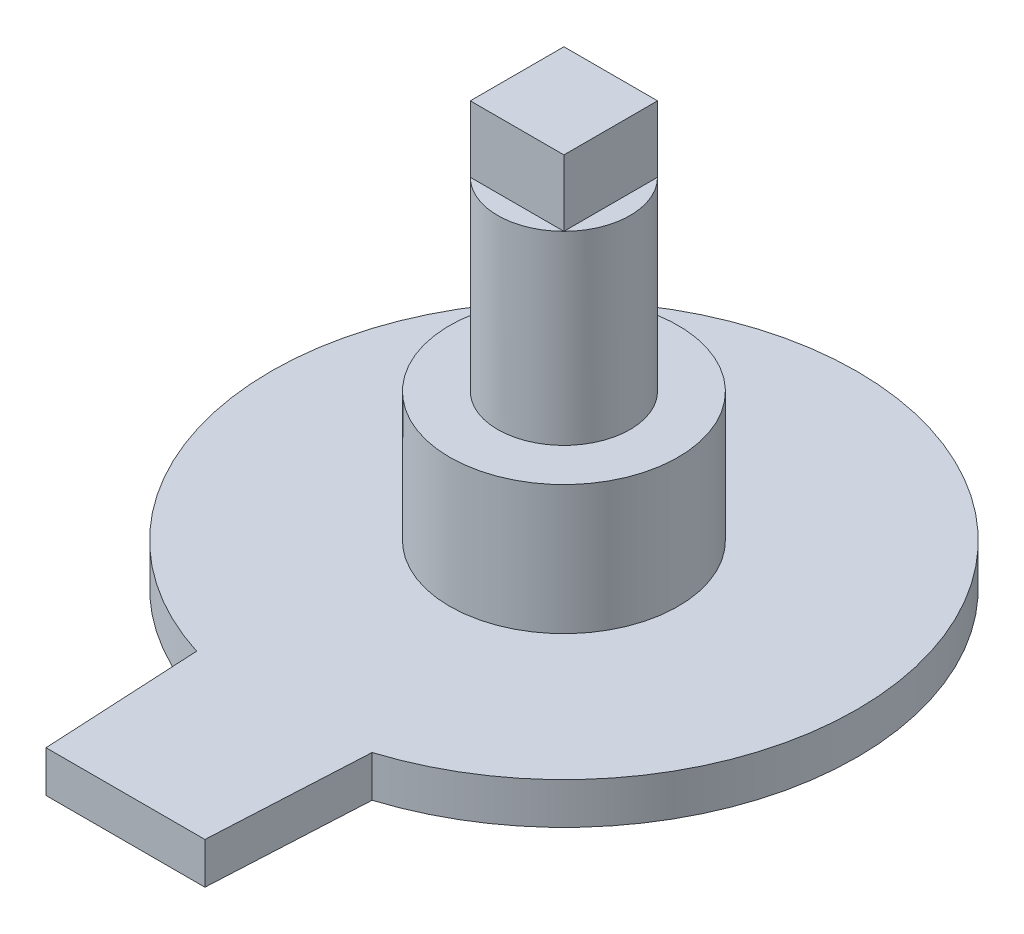
from build123d import *

# Parameters (mm, degrees)
SKETCH1_R           = 8.85
BOSS_EXTRUDE1_DEPTH = 1.25
SKETCH2_R           = 3.45
BOSS_EXTRUDE2_DEPTH = 3.9
SKETCH3_R           = 2
BOSS_EXTRUDE3_DEPTH = 5.6
SKETCH4_W           = 2.828427124
SKETCH4_H           = 2.828427124
BOSS_EXTRUDE4_DEPTH = 2
BOSS_EXTRUDE5_DEPTH = 1.25


with BuildPart() as part:
    # Sketch1 → Boss-Extrude1 (new body)
    with BuildSketch(Plane(origin=(0, 0, 0), x_dir=(1, 0, 0), z_dir=(0, 1, 0))):
        with Locations(Location((0, 0, 0), (0, 0, 270))):
            Circle(SKETCH1_R)
    extrude(amount=BOSS_EXTRUDE1_DEPTH)

    # Sketch2 → Boss-Extrude2 (add)
    with BuildSketch(Plane(origin=(0, 1.25, 0), x_dir=(1, 0, 0), z_dir=(0, 1, 0))):
        with Locations(Location((0, 0, 0), (0, 0, 270))):
            Circle(SKETCH2_R)
    extrude(amount=BOSS_EXTRUDE2_DEPTH)

    # Sketch3 → Boss-Extrude3 (add)
    with BuildSketch(Plane(origin=(0, 5.15, 0), x_dir=(1, 0, 0), z_dir=(0, 1, 0))):
        with Locations(Location((0, 0, 0), (0, 0, 270))):
            Circle(SKETCH3_R)
    extrude(amount=BOSS_EXTRUDE3_DEPTH)

    # Sketch4 → Boss-Extrude4 (add)
    with BuildSketch(Plane(origin=(0, 10.75, 0), x_dir=(1, 0, 0), z_dir=(0, 1, 0))):
        Rectangle(SKETCH4_W, SKETCH4_H)
    extrude(amount=BOSS_EXTRUDE4_DEPTH)

    # Sketch5 → Boss-Extrude5 (add)
    with BuildSketch(Plane.XZ):
        with BuildLine():
            ThreePointArc((-2.65, 8.443932733), (-1.340465463, 8.747894166), (0, 8.85))
            Line((0, 8.85), (0, 13.243932733))
            Line((0, 13.243932733), (-2.4, 13.243932733))
            Line((-2.4, 13.243932733), (-2.65, 8.443932733))
        make_face()
        with BuildLine():
            Line((0, 13.243932733), (0, 8.85))
            ThreePointArc((0, 8.85), (1.340465463, 8.747894166), (2.65, 8.443932733))
            Line((2.65, 8.443932733), (2.4, 13.243932733))
            Line((2.4, 13.243932733), (0, 13.243932733))
        make_face()
    extrude(amount=-BOSS_EXTRUDE5_DEPTH)


solid = part.part
